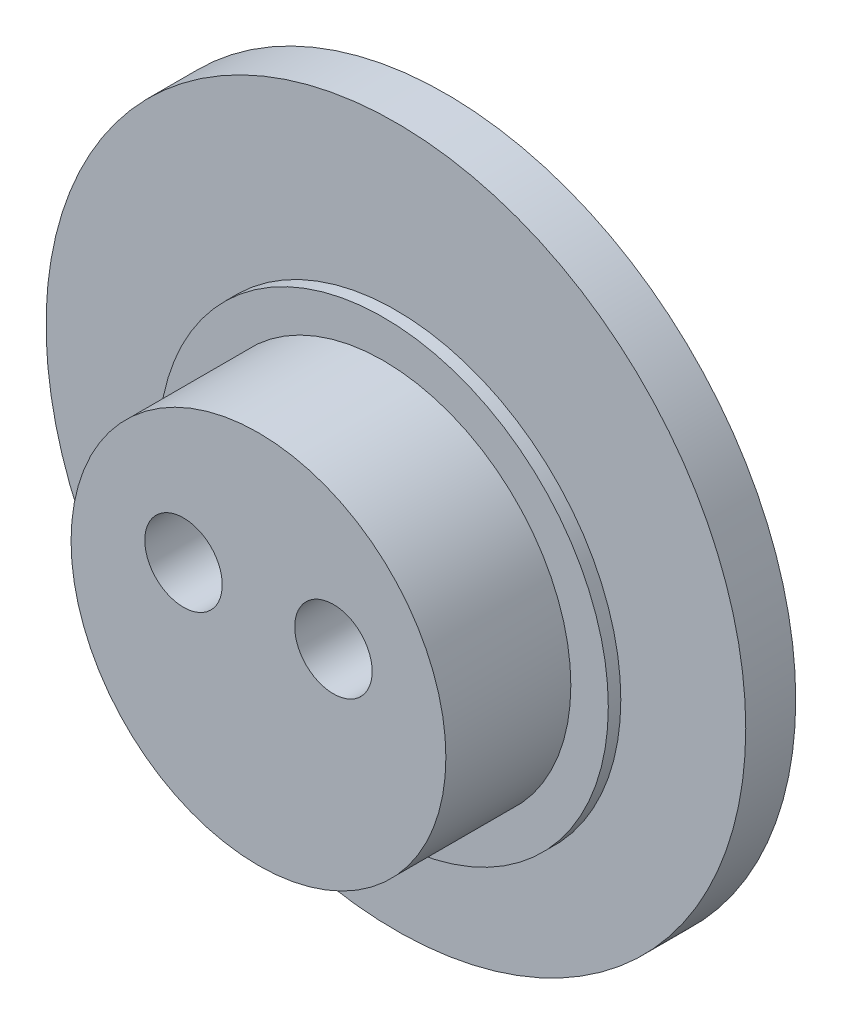
from build123d import *

# Parameters (mm, degrees)
SKETCH1_R           = 14
BOSS_EXTRUDE1_DEPTH = 2
SKETCH2_R           = 9
BOSS_EXTRUDE2_DEPTH = 0.5
SKETCH4_R           = 7.5
BOSS_EXTRUDE3_DEPTH = 5
SKETCH6_R           = 9
BOSS_EXTRUDE4_DEPTH = 0.5
SKETCH5_R           = 1.55
CUT_EXTRUDE1_DEPTH  = 22.354156504


with BuildPart() as part:
    # Sketch1 → Boss-Extrude1 (new body)
    with BuildSketch(Plane.XY):
        Circle(SKETCH1_R)
    extrude(amount=BOSS_EXTRUDE1_DEPTH)

    # Sketch2 → Boss-Extrude2 (add)
    with BuildSketch(Plane.XY.offset(2)):
        with Locations((0, -1.5)):
            Circle(SKETCH2_R)
    extrude(amount=BOSS_EXTRUDE2_DEPTH)

    # Sketch4 → Boss-Extrude3 (add)
    with BuildSketch(Plane.XY.offset(2.5)):
        with Locations((0, -1.5)):
            Circle(SKETCH4_R)
    extrude(amount=BOSS_EXTRUDE3_DEPTH)

    # Sketch6 → Boss-Extrude4 (add)
    with BuildSketch(Plane(origin=(0, 0, 0), x_dir=(-1, 0, 0), z_dir=(0, 0, -1))):
        with Locations((0, 1.5)):
            Circle(SKETCH6_R)
    extrude(amount=BOSS_EXTRUDE4_DEPTH)

    # Sketch5 → Cut-Extrude1 (cut, through all)
    with BuildSketch(Plane.XY.offset(7.5)):
        with Locations((3, 0)):
            Circle(SKETCH5_R)
        with Locations(Location((-3, 0, 0), (0, 0, 180))):
            Circle(SKETCH5_R)
    extrude(amount=-CUT_EXTRUDE1_DEPTH, mode=Mode.SUBTRACT)


solid = part.part
